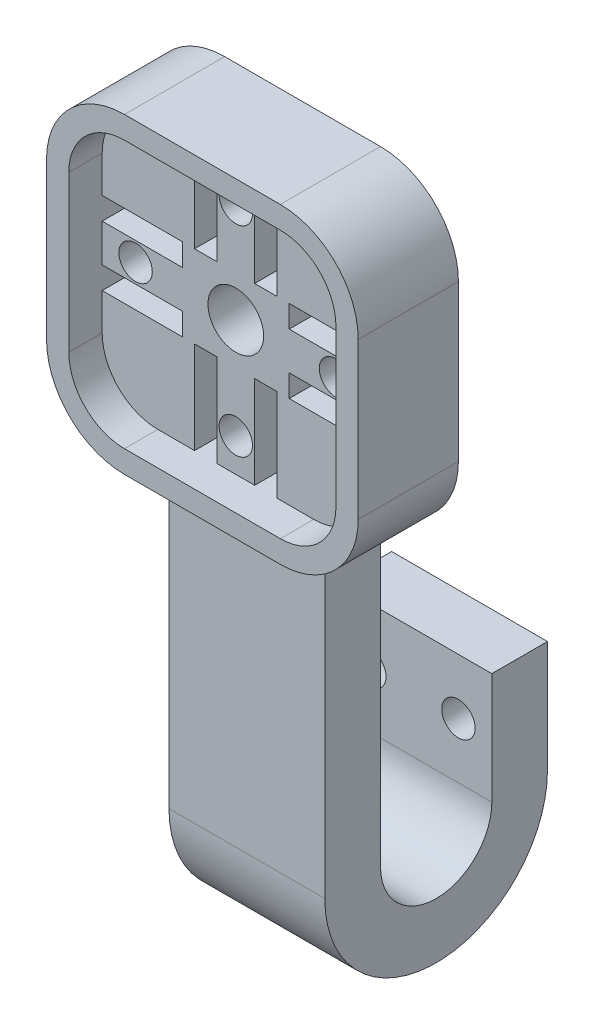
from build123d import *

# Parameters (mm, degrees)
Y_KSEKLIK_EKSTR_ZYON1_DEPTH = 9
Y_KSEKLIK_EKSTR_ZYON2_DEPTH = 6
IZIM4_R                     = 1.5
IZIM4_R_2                   = 2.5
KES_EKSTR_ZYON2_DEPTH       = 6.5
IZIM5_W                     = 14
IZIM5_H                     = 15
Y_KSEKLIK_EKSTR_ZYON3_DEPTH = 5
Y_KSEKLIK_EKSTR_ZYON4_DEPTH = 7
IZIM3_W                     = 7.2
IZIM3_H                     = 2
IZIM3_W_2                   = 2
IZIM3_H_2                   = 8.3
KES_EKSTR_ZYON3_DEPTH       = 3
IZIM8_R                     = 1.5
KES_EKSTR_ZYON5_DEPTH       = 10
IZIM9_R                     = 2.5
IZIM9_R_2                   = 4
KES_EKSTR_ZYON6_DEPTH       = 2
IZIM11_R                    = 2.5
KES_EKSTR_ZYON8_DEPTH       = 2
KES_EKSTR_ZYON9_START       = -10
KES_EKSTR_ZYON9_DEPTH       = 10
IZIM14_W                    = 14
IZIM14_H                    = 3
Y_KSEKLIK_EKSTR_ZYON5_DEPTH = 5


with BuildPart() as part:
    # Çizim1 → Yükseklik-Ekstrüzyon1 (new body)
    with BuildSketch(Plane.XY):
        with BuildLine():
            Line((17, 7), (17, -7))
            ThreePointArc((17, -7), (14.071067812, -14.071067812), (7, -17))
            Line((7, -17), (-7, -17))
            ThreePointArc((-7, -17), (-14.071067812, -14.071067812), (-17, -7))
            Line((-17, -7), (-17, 7))
            ThreePointArc((-17, 7), (-14.071067812, 14.071067812), (-7, 17))
            Line((-7, 17), (7, 17))
            ThreePointArc((7, 17), (14.071067812, 14.071067812), (17, 7))
        make_face()
        with BuildLine():
            Line((-7, 12), (7, 12))
            ThreePointArc((7, 12), (10.535533906, 10.535533906), (12, 7))
            Line((12, 7), (12, -7))
            ThreePointArc((12, -7), (10.535533906, -10.535533906), (7, -12))
            Line((7, -12), (-7, -12))
            ThreePointArc((-7, -12), (-10.535533906, -10.535533906), (-12, -7))
            Line((-12, -7), (-12, 7))
            ThreePointArc((-12, 7), (-10.535533906, 10.535533906), (-7, 12))
        make_face(mode=Mode.SUBTRACT)
    extrude(amount=Y_KSEKLIK_EKSTR_ZYON1_DEPTH)

    # Çizim2 → Yükseklik-Ekstrüzyon2 (add)
    with BuildSketch(Plane.XY):
        with BuildLine():
            Line((-7, -12), (7, -12))
            ThreePointArc((7, -12), (10.535533906, -10.535533906), (12, -7))
            Line((12, -7), (12, 7))
            ThreePointArc((12, 7), (10.535533906, 10.535533906), (7, 12))
            Line((7, 12), (-7, 12))
            ThreePointArc((-7, 12), (-10.535533906, 10.535533906), (-12, 7))
            Line((-12, 7), (-12, -7))
            ThreePointArc((-12, -7), (-10.535533906, -10.535533906), (-7, -12))
        make_face()
    extrude(amount=Y_KSEKLIK_EKSTR_ZYON2_DEPTH)

    # Çizim4 → Kes-Ekstrüzyon2 (cut)
    with BuildSketch(Plane.XY.offset(6)):
        with Locations((0, 9)):
            Circle(IZIM4_R)
        Circle(IZIM4_R_2)
        with Locations((9, 0)):
            Circle(IZIM4_R)
        with Locations((0, -9)):
            Circle(IZIM4_R)
        with Locations((-9, 0)):
            Circle(IZIM4_R)
    extrude(amount=-KES_EKSTR_ZYON2_DEPTH, mode=Mode.SUBTRACT)

    # Çizim5 → Yükseklik-Ekstrüzyon3 (add)
    with BuildSketch(Plane.XY):
        with Locations((0, -24.5)):
            Rectangle(IZIM5_W, IZIM5_H)
    extrude(amount=Y_KSEKLIK_EKSTR_ZYON3_DEPTH)

    # Çizim6 → Yükseklik-Ekstrüzyon4 (add, symmetric)
    with BuildSketch(Plane(origin=(0, 0, 0), x_dir=(0, 0, -1), z_dir=(1, 0, 0))):
        with BuildLine():
            Line((0, -32), (-5, -32))
            Line((-5, -32), (-5, -42))
            ThreePointArc((-5, -42), (5, -52), (15, -42))
            Line((15, -42), (15, -32))
            Line((15, -32), (10, -32))
            Line((10, -32), (10, -42))
            ThreePointArc((10, -42), (5, -47), (0, -42))
            Line((0, -42), (0, -32))
        make_face()
    extrude(amount=Y_KSEKLIK_EKSTR_ZYON4_DEPTH, both=True)

    # Çizim3 → Kes-Ekstrüzyon3 (cut)
    with BuildSketch(Plane.XY.offset(6)):
        with Locations((8.4, 2.7)):
            Rectangle(IZIM3_W, IZIM3_H)
        with Locations((2.7, 7.85)):
            Rectangle(IZIM3_W_2, IZIM3_H_2)
        with Locations((-2.7, 7.85)):
            Rectangle(IZIM3_W_2, IZIM3_H_2)
        with Locations((-8.4, 2.7)):
            Rectangle(IZIM3_W, IZIM3_H)
        with Locations((-8.4, -2.7)):
            Rectangle(IZIM3_W, IZIM3_H)
        with Locations((-2.7, -7.85)):
            Rectangle(IZIM3_W_2, IZIM3_H_2)
        with Locations((2.7, -7.85)):
            Rectangle(IZIM3_W_2, IZIM3_H_2)
        with Locations((8.4, -2.7)):
            Rectangle(IZIM3_W, IZIM3_H)
    extrude(amount=-KES_EKSTR_ZYON3_DEPTH, mode=Mode.SUBTRACT)

    # Çizim8 → Kes-Ekstrüzyon5 (cut)
    with BuildSketch(Plane.XY.offset(-10)):
        with Locations((-4, -37)):
            Circle(IZIM8_R)
        with Locations((4, -37)):
            Circle(IZIM8_R)
    extrude(amount=-KES_EKSTR_ZYON5_DEPTH, mode=Mode.SUBTRACT)

    # Çizim9 → Kes-Ekstrüzyon6 (cut)
    with BuildSketch(Plane(origin=(0, 0, 0), x_dir=(-1, 0, 0), z_dir=(0, 0, -1))):
        with Locations((0, 9)):
            Circle(IZIM9_R)
        Circle(IZIM9_R_2)
        with Locations((9, 0)):
            Circle(IZIM9_R)
        with Locations((0, -9)):
            Circle(IZIM9_R)
        with Locations((-9, 0)):
            Circle(IZIM9_R)
    extrude(amount=-KES_EKSTR_ZYON6_DEPTH, mode=Mode.SUBTRACT)

    # Çizim11 → Kes-Ekstrüzyon8 (cut)
    with BuildSketch(Plane(origin=(0, 0, -15), x_dir=(-1, 0, 0), z_dir=(0, 0, -1))):
        with Locations((-4, -37)):
            Circle(IZIM11_R)
        with Locations((4, -37)):
            Circle(IZIM11_R)
    extrude(amount=-KES_EKSTR_ZYON8_DEPTH, mode=Mode.SUBTRACT)

    # Çizim12 → Kes-Ekstrüzyon9 (cut)
    with BuildSketch(Plane.XY.offset(9).offset(KES_EKSTR_ZYON9_START)):
        with BuildLine():
            Line((7, 17), (-7, 17))
            ThreePointArc((-7, 17), (-14.071067812, 14.071067812), (-17, 7))
            Line((-17, 7), (-17, -7))
            ThreePointArc((-17, -7), (-14.071067812, -14.071067812), (-7, -17))
            Line((-7, -17), (7, -17))
            ThreePointArc((7, -17), (14.071067812, -14.071067812), (17, -7))
            Line((17, -7), (17, 7))
            ThreePointArc((17, 7), (14.071067812, 14.071067812), (7, 17))
        make_face()
        with BuildLine():
            Line((7, 14), (-7, 14))
            ThreePointArc((-7, 14), (-11.949747468, 11.949747468), (-14, 7))
            Line((-14, 7), (-14, -7))
            ThreePointArc((-14, -7), (-11.949747468, -11.949747468), (-7, -14))
            Line((-7, -14), (7, -14))
            ThreePointArc((7, -14), (11.949747468, -11.949747468), (14, -7))
            Line((14, -7), (14, 7))
            ThreePointArc((14, 7), (11.949747468, 11.949747468), (7, 14))
        make_face(mode=Mode.SUBTRACT)
    extrude(amount=KES_EKSTR_ZYON9_DEPTH, mode=Mode.SUBTRACT)


with BuildPart() as kes_ekstr_zyon9_piece_1:
    # of the separate pieces the step leaves, piece 1, a body of its own (kes_ekstr_zyon9_pieces)
    add(part.part.solids().sort_by_distance((7, 14, 0))[0])



with BuildPart() as kes_ekstr_zyon9_piece_2:
    # of the separate pieces the step leaves, piece 2, a body of its own (kes_ekstr_zyon9_pieces)
    add(part.part.solids().sort_by_distance((-7, -42, 0))[0])


with BuildPart() as kes_ekstr_zyon9_piece_1_1:
    add(kes_ekstr_zyon9_piece_1.part)

    add(kes_ekstr_zyon9_piece_2.part)  # Yükseklik-Ekstrüzyon5 merges Kes-Ekstrüzyon9 piece 2
    # Çizim14 → Yükseklik-Ekstrüzyon5 (add)
    with BuildSketch(Plane.XY):
        with Locations((0, -15.5)):
            Rectangle(IZIM14_W, IZIM14_H)
    extrude(amount=Y_KSEKLIK_EKSTR_ZYON5_DEPTH)


solid = kes_ekstr_zyon9_piece_1_1.part
